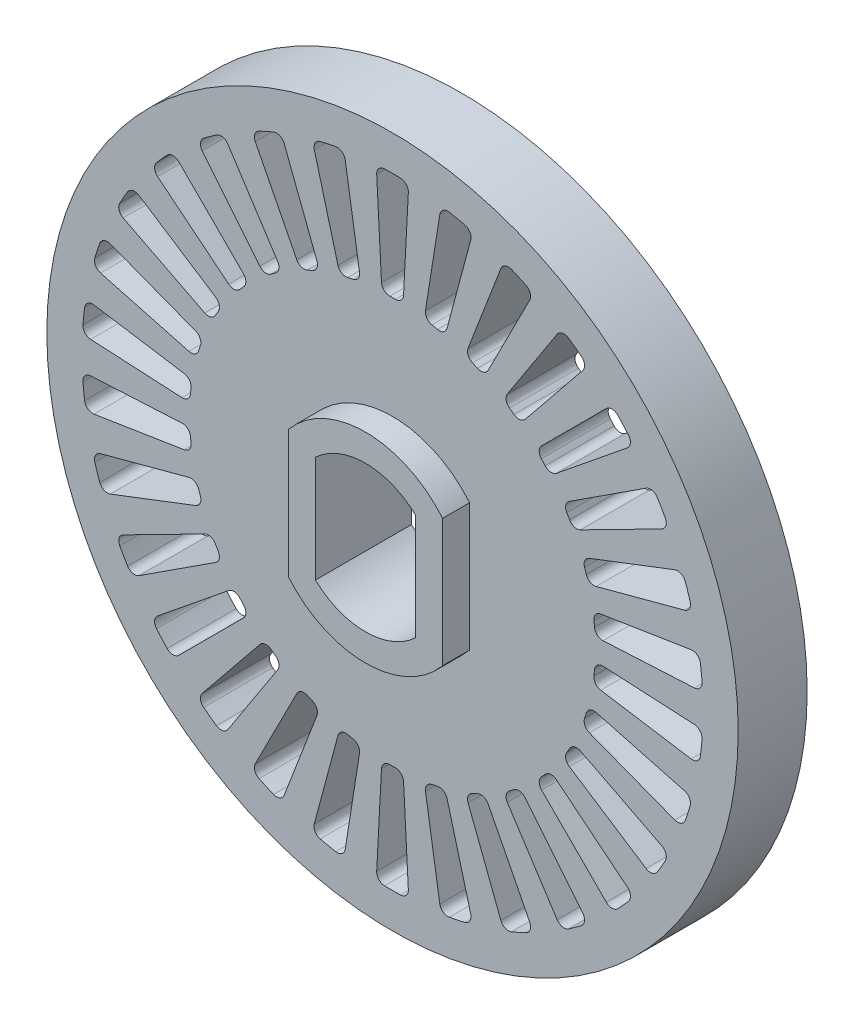
from build123d import *

# Parameters (mm, degrees)
ESBO_O1_R                = 12.78
RESSALTO_EXTRUS_O1_DEPTH = 2.55
RESSALTO_EXTRUS_O2_DEPTH = 3.55
CORTE_EXTRUS_O1_DEPTH    = 3.55


with BuildPart() as part:
    # Esboço1 → Ressalto-extrusão1 (new body)
    with BuildSketch(Plane.XY):
        Circle(ESBO_O1_R)
        with BuildLine():
            Line((-1.85, 1.966596044), (-1.85, -1.966596044))
            ThreePointArc((-1.85, -1.966596044), (0, -2.7), (1.85, -1.966596044))
            Line((1.85, -1.966596044), (1.85, 1.966596044))
            ThreePointArc((1.85, 1.966596044), (0, 2.7), (-1.85, 1.966596044))
        make_face(mode=Mode.SUBTRACT)
    extrude(amount=RESSALTO_EXTRUS_O1_DEPTH)

    # Esboço2 → Ressalto-extrusão2 (add)
    with BuildSketch(Plane.XY):
        with BuildLine():
            ThreePointArc((-2.85, -2.359555043), (0, -3.7), (2.85, -2.359555043))
            Line((2.85, -2.359555043), (2.85, 2.359555043))
            ThreePointArc((2.85, 2.359555043), (0, 3.7), (-2.85, 2.359555043))
            Line((-2.85, 2.359555043), (-2.85, -2.359555043))
        make_face()
        with BuildLine():
            Line((-1.85, 1.966596044), (-1.85, -1.966596044))
            ThreePointArc((-1.85, -1.966596044), (0, -2.7), (1.85, -1.966596044))
            Line((1.85, -1.966596044), (1.85, 1.966596044))
            ThreePointArc((1.85, 1.966596044), (0, 2.7), (-1.85, 1.966596044))
        make_face(mode=Mode.SUBTRACT)
    extrude(amount=RESSALTO_EXTRUS_O2_DEPTH)

    # Esboço3 → Corte-extrusão1 (cut)
    with BuildSketch(Plane.XY.offset(2.55)):
        with BuildLine():
            Line((0.407918409, 7.783546915), (0.584905298, 11.160657946))
            ThreePointArc((0.584905298, 11.160657946), (0.505546292, 11.380071304), (0.292972514, 11.476261025))
            ThreePointArc((0.292972514, 11.476261025), (0, 11.48), (-0.292972514, 11.476261025))
            ThreePointArc((-0.292972514, 11.476261025), (-0.505546292, 11.380071304), (-0.584905298, 11.160657946))
            Line((-0.584905298, 11.160657946), (-0.407918409, 7.783546915))
            ThreePointArc((-0.407918409, 7.783546915), (-0.313319761, 7.580206581), (-0.104163027, 7.499276636))
            ThreePointArc((-0.104163027, 7.499276636), (0, 7.5), (0.104163027, 7.499276636))
            ThreePointArc((0.104163027, 7.499276636), (0.313319761, 7.580206581), (0.407918409, 7.783546915))
        make_face()
        with BuildLine():
            Line((2.017294812, 7.528646734), (2.892554978, 10.795162143))
            ThreePointArc((2.892554978, 10.795162143), (2.860548759, 11.026280458), (2.672619196, 11.164564776))
            ThreePointArc((2.672619196, 11.164564776), (2.386826211, 11.229134456), (2.099478472, 11.286389597))
            ThreePointArc((2.099478472, 11.286389597), (1.871550974, 11.236498426), (1.74830755, 11.038379442))
            Line((1.74830755, 11.038379442), (1.219285987, 7.698268746))
            ThreePointArc((1.219285987, 7.698268746), (1.269540594, 7.479703721), (1.45730047, 7.35705616))
            ThreePointArc((1.45730047, 7.35705616), (1.559337681, 7.336107006), (1.6610741, 7.313742738))
            ThreePointArc((1.6610741, 7.313742738), (1.88248654, 7.349418039), (2.017294812, 7.528646734))
        make_face()
        with BuildLine():
            Line((3.538505753, 6.944708564), (5.073786126, 9.957865954))
            ThreePointArc((5.073786126, 9.957865954), (5.090531519, 10.190588246), (4.935459594, 10.364923473))
            ThreePointArc((4.935459594, 10.364923473), (4.669336663, 10.487501854), (4.400172175, 10.603248787))
            ThreePointArc((4.400172175, 10.603248787), (4.166852482, 10.601836649), (4.005110969, 10.433670789))
            Line((4.005110969, 10.433670789), (2.793201734, 7.276539292))
            ThreePointArc((2.793201734, 7.276539292), (2.796915934, 7.052301918), (2.955072944, 6.893297026))
            ThreePointArc((2.955072944, 6.893297026), (3.050524823, 6.851590932), (3.145388265, 6.808563186))
            ThreePointArc((3.145388265, 6.808563186), (3.369379623, 6.797424662), (3.538505753, 6.944708564))
        make_face()
        with BuildLine():
            Line((4.905067012, 6.057253306), (7.033268473, 8.685363239))
            ThreePointArc((7.033268473, 8.685363239), (7.098033624, 8.909518427), (6.982596724, 9.112285278))
            ThreePointArc((6.982596724, 9.112285278), (6.747774696, 9.287515095), (6.508557239, 9.456695124))
            ThreePointArc((6.508557239, 9.456695124), (6.280042541, 9.503823737), (6.08687182, 9.372960655))
            Line((6.08687182, 9.372960655), (4.245041162, 6.536790155))
            ThreePointArc((4.245041162, 6.536790155), (4.202052626, 6.31668068), (4.32369455, 6.128267735))
            ThreePointArc((4.32369455, 6.128267735), (4.408389392, 6.067627458), (4.492233869, 6.005816753))
            ThreePointArc((4.492233869, 6.005816753), (4.709014649, 5.94835121), (4.905067012, 6.057253306))
        make_face()
        with BuildLine():
            Line((6.057253306, 4.905067012), (8.685363239, 7.033268473))
            ThreePointArc((8.685363239, 7.033268473), (8.7953176, 7.239059901), (8.724560872, 7.46139649))
            ThreePointArc((8.724560872, 7.46139649), (8.531302596, 7.681619361), (8.33248712, 7.896838506))
            ThreePointArc((8.33248712, 7.896838506), (8.118764606, 7.990448123), (7.902607165, 7.902607165))
            Line((7.902607165, 7.902607165), (5.511351921, 5.511351921))
            ThreePointArc((5.511351921, 5.511351921), (5.423539455, 5.304990185), (5.503349957, 5.095403737))
            ThreePointArc((5.503349957, 5.095403737), (5.573586191, 5.018479548), (5.642747296, 4.940587308))
            ThreePointArc((5.642747296, 4.940587308), (5.842843139, 4.839306266), (6.057253306, 4.905067012))
        make_face()
        with BuildLine():
            Line((6.944708564, 3.538505753), (9.957865954, 5.073786126))
            ThreePointArc((9.957865954, 5.073786126), (10.108203992, 5.25221972), (10.085219845, 5.484408873))
            ThreePointArc((10.085219845, 5.484408873), (9.941971635, 5.74), (9.792247331, 5.991852152))
            ThreePointArc((9.792247331, 5.991852152), (9.6026577, 6.127851583), (9.372960655, 6.08687182))
            Line((9.372960655, 6.08687182), (6.536790155, 4.245041162))
            ThreePointArc((6.536790155, 4.245041162), (6.407991584, 4.061446163), (6.442482563, 3.839846146))
            ThreePointArc((6.442482563, 3.839846146), (6.495190528, 3.75), (6.54664559, 3.65943049))
            ThreePointArc((6.54664559, 3.65943049), (6.721311346, 3.518760418), (6.944708564, 3.538505753))
        make_face()
        with BuildLine():
            Line((7.528646734, 2.017294812), (10.795162143, 2.892554978))
            ThreePointArc((10.795162143, 2.892554978), (10.979313365, 3.035832335), (11.005106316, 3.26772627))
            ThreePointArc((11.005106316, 3.26772627), (10.918128807, 3.547515095), (10.824039344, 3.824993107))
            ThreePointArc((10.824039344, 3.824993107), (10.666868574, 3.997438525), (10.433670789, 4.005110969))
            Line((10.433670789, 4.005110969), (7.276539292, 2.793201734))
            ThreePointArc((7.276539292, 2.793201734), (7.112383733, 2.640397455), (7.100047767, 2.416468852))
            ThreePointArc((7.100047767, 2.416468852), (7.132923872, 2.317627458), (7.164424058, 2.218339))
            ThreePointArc((7.164424058, 2.218339), (7.306025995, 2.044427854), (7.528646734, 2.017294812))
        make_face()
        with BuildLine():
            Line((7.783546915, 0.407918409), (11.160657946, 0.584905298))
            ThreePointArc((11.160657946, 0.584905298), (11.370574059, 0.686764509), (11.444016833, 0.908228349))
            ThreePointArc((11.444016833, 0.908228349), (11.417111359, 1.199986758), (11.382768899, 1.490963509))
            ThreePointArc((11.382768899, 1.490963509), (11.264886105, 1.692318222), (11.038379442, 1.74830755))
            Line((11.038379442, 1.74830755), (7.698268746, 1.219285987))
            ThreePointArc((7.698268746, 1.219285987), (7.505930583, 1.103950708), (7.447306813, 0.887480274))
            ThreePointArc((7.447306813, 0.887480274), (7.458914215, 0.783963475), (7.469082815, 0.680295451))
            ThreePointArc((7.469082815, 0.680295451), (7.571432249, 0.480743982), (7.783546915, 0.407918409))
        make_face()
        with BuildLine():
            Line((7.698268746, -1.219285987), (11.038379442, -1.74830755))
            ThreePointArc((11.038379442, -1.74830755), (11.264886105, -1.692318222), (11.382768899, -1.490963509))
            ThreePointArc((11.382768899, -1.490963509), (11.417111359, -1.199986758), (11.444016833, -0.908228349))
            ThreePointArc((11.444016833, -0.908228349), (11.370574059, -0.686764509), (11.160657946, -0.584905298))
            Line((11.160657946, -0.584905298), (7.783546915, -0.407918409))
            ThreePointArc((7.783546915, -0.407918409), (7.571432249, -0.480743982), (7.469082815, -0.680295451))
            ThreePointArc((7.469082815, -0.680295451), (7.458914215, -0.783963475), (7.447306813, -0.887480274))
            ThreePointArc((7.447306813, -0.887480274), (7.505930583, -1.103950708), (7.698268746, -1.219285987))
        make_face()
        with BuildLine():
            Line((7.276539292, -2.793201734), (10.433670789, -4.005110969))
            ThreePointArc((10.433670789, -4.005110969), (10.666868574, -3.997438525), (10.824039344, -3.824993107))
            ThreePointArc((10.824039344, -3.824993107), (10.918128807, -3.547515095), (11.005106316, -3.26772627))
            ThreePointArc((11.005106316, -3.26772627), (10.979313365, -3.035832335), (10.795162143, -2.892554978))
            Line((10.795162143, -2.892554978), (7.528646734, -2.017294812))
            ThreePointArc((7.528646734, -2.017294812), (7.306025995, -2.044427854), (7.164424058, -2.218339))
            ThreePointArc((7.164424058, -2.218339), (7.132923872, -2.317627458), (7.100047767, -2.416468852))
            ThreePointArc((7.100047767, -2.416468852), (7.112383733, -2.640397455), (7.276539292, -2.793201734))
        make_face()
        with BuildLine():
            Line((6.536790155, -4.245041162), (9.372960655, -6.08687182))
            ThreePointArc((9.372960655, -6.08687182), (9.6026577, -6.127851583), (9.792247331, -5.991852152))
            ThreePointArc((9.792247331, -5.991852152), (9.941971635, -5.74), (10.085219845, -5.484408873))
            ThreePointArc((10.085219845, -5.484408873), (10.108203992, -5.25221972), (9.957865954, -5.073786126))
            Line((9.957865954, -5.073786126), (6.944708564, -3.538505753))
            ThreePointArc((6.944708564, -3.538505753), (6.721311346, -3.518760418), (6.54664559, -3.65943049))
            ThreePointArc((6.54664559, -3.65943049), (6.495190528, -3.75), (6.442482563, -3.839846146))
            ThreePointArc((6.442482563, -3.839846146), (6.407991584, -4.061446163), (6.536790155, -4.245041162))
        make_face()
        with BuildLine():
            Line((5.511351921, -5.511351921), (7.902607165, -7.902607165))
            ThreePointArc((7.902607165, -7.902607165), (8.118764606, -7.990448123), (8.33248712, -7.896838506))
            ThreePointArc((8.33248712, -7.896838506), (8.531302596, -7.681619361), (8.724560872, -7.46139649))
            ThreePointArc((8.724560872, -7.46139649), (8.7953176, -7.239059901), (8.685363239, -7.033268473))
            Line((8.685363239, -7.033268473), (6.057253306, -4.905067012))
            ThreePointArc((6.057253306, -4.905067012), (5.842843139, -4.839306266), (5.642747296, -4.940587308))
            ThreePointArc((5.642747296, -4.940587308), (5.573586191, -5.018479548), (5.503349957, -5.095403737))
            ThreePointArc((5.503349957, -5.095403737), (5.423539455, -5.304990185), (5.511351921, -5.511351921))
        make_face()
        with BuildLine():
            Line((4.245041162, -6.536790155), (6.08687182, -9.372960655))
            ThreePointArc((6.08687182, -9.372960655), (6.280042541, -9.503823737), (6.508557239, -9.456695124))
            ThreePointArc((6.508557239, -9.456695124), (6.747774696, -9.287515095), (6.982596724, -9.112285278))
            ThreePointArc((6.982596724, -9.112285278), (7.098033624, -8.909518427), (7.033268473, -8.685363239))
            Line((7.033268473, -8.685363239), (4.905067012, -6.057253306))
            ThreePointArc((4.905067012, -6.057253306), (4.709014649, -5.94835121), (4.492233869, -6.005816753))
            ThreePointArc((4.492233869, -6.005816753), (4.408389392, -6.067627458), (4.32369455, -6.128267735))
            ThreePointArc((4.32369455, -6.128267735), (4.202052626, -6.31668068), (4.245041162, -6.536790155))
        make_face()
        with BuildLine():
            Line((2.793201734, -7.276539292), (4.005110969, -10.433670789))
            ThreePointArc((4.005110969, -10.433670789), (4.166852482, -10.601836649), (4.400172175, -10.603248787))
            ThreePointArc((4.400172175, -10.603248787), (4.669336663, -10.487501854), (4.935459594, -10.364923473))
            ThreePointArc((4.935459594, -10.364923473), (5.090531519, -10.190588246), (5.073786126, -9.957865954))
            Line((5.073786126, -9.957865954), (3.538505753, -6.944708564))
            ThreePointArc((3.538505753, -6.944708564), (3.369379623, -6.797424662), (3.145388265, -6.808563186))
            ThreePointArc((3.145388265, -6.808563186), (3.050524823, -6.851590932), (2.955072944, -6.893297026))
            ThreePointArc((2.955072944, -6.893297026), (2.796915934, -7.052301918), (2.793201734, -7.276539292))
        make_face()
        with BuildLine():
            Line((1.219285987, -7.698268746), (1.74830755, -11.038379442))
            ThreePointArc((1.74830755, -11.038379442), (1.871550974, -11.236498426), (2.099478472, -11.286389597))
            ThreePointArc((2.099478472, -11.286389597), (2.386826211, -11.229134456), (2.672619196, -11.164564776))
            ThreePointArc((2.672619196, -11.164564776), (2.860548759, -11.026280458), (2.892554978, -10.795162143))
            Line((2.892554978, -10.795162143), (2.017294812, -7.528646734))
            ThreePointArc((2.017294812, -7.528646734), (1.88248654, -7.349418039), (1.6610741, -7.313742738))
            ThreePointArc((1.6610741, -7.313742738), (1.559337681, -7.336107006), (1.45730047, -7.35705616))
            ThreePointArc((1.45730047, -7.35705616), (1.269540594, -7.479703721), (1.219285987, -7.698268746))
        make_face()
        with BuildLine():
            Line((-0.407918409, -7.783546915), (-0.584905298, -11.160657946))
            ThreePointArc((-0.584905298, -11.160657946), (-0.505546292, -11.380071304), (-0.292972514, -11.476261025))
            ThreePointArc((-0.292972514, -11.476261025), (0, -11.48), (0.292972514, -11.476261025))
            ThreePointArc((0.292972514, -11.476261025), (0.505546292, -11.380071304), (0.584905298, -11.160657946))
            Line((0.584905298, -11.160657946), (0.407918409, -7.783546915))
            ThreePointArc((0.407918409, -7.783546915), (0.313319761, -7.580206581), (0.104163027, -7.499276636))
            ThreePointArc((0.104163027, -7.499276636), (0, -7.5), (-0.104163027, -7.499276636))
            ThreePointArc((-0.104163027, -7.499276636), (-0.313319761, -7.580206581), (-0.407918409, -7.783546915))
        make_face()
        with BuildLine():
            Line((-2.017294812, -7.528646734), (-2.892554978, -10.795162143))
            ThreePointArc((-2.892554978, -10.795162143), (-2.860548759, -11.026280458), (-2.672619196, -11.164564776))
            ThreePointArc((-2.672619196, -11.164564776), (-2.386826211, -11.229134456), (-2.099478472, -11.286389597))
            ThreePointArc((-2.099478472, -11.286389597), (-1.871550974, -11.236498426), (-1.74830755, -11.038379442))
            Line((-1.74830755, -11.038379442), (-1.219285987, -7.698268746))
            ThreePointArc((-1.219285987, -7.698268746), (-1.269540594, -7.479703721), (-1.45730047, -7.35705616))
            ThreePointArc((-1.45730047, -7.35705616), (-1.559337681, -7.336107006), (-1.6610741, -7.313742738))
            ThreePointArc((-1.6610741, -7.313742738), (-1.88248654, -7.349418039), (-2.017294812, -7.528646734))
        make_face()
        with BuildLine():
            Line((-3.538505753, -6.944708564), (-5.073786126, -9.957865954))
            ThreePointArc((-5.073786126, -9.957865954), (-5.090531519, -10.190588246), (-4.935459594, -10.364923473))
            ThreePointArc((-4.935459594, -10.364923473), (-4.669336663, -10.487501854), (-4.400172175, -10.603248787))
            ThreePointArc((-4.400172175, -10.603248787), (-4.166852482, -10.601836649), (-4.005110969, -10.433670789))
            Line((-4.005110969, -10.433670789), (-2.793201734, -7.276539292))
            ThreePointArc((-2.793201734, -7.276539292), (-2.796915934, -7.052301918), (-2.955072944, -6.893297026))
            ThreePointArc((-2.955072944, -6.893297026), (-3.050524823, -6.851590932), (-3.145388265, -6.808563186))
            ThreePointArc((-3.145388265, -6.808563186), (-3.369379623, -6.797424662), (-3.538505753, -6.944708564))
        make_face()
        with BuildLine():
            Line((-4.905067012, -6.057253306), (-7.033268473, -8.685363239))
            ThreePointArc((-7.033268473, -8.685363239), (-7.098033624, -8.909518427), (-6.982596724, -9.112285278))
            ThreePointArc((-6.982596724, -9.112285278), (-6.747774696, -9.287515095), (-6.508557239, -9.456695124))
            ThreePointArc((-6.508557239, -9.456695124), (-6.280042541, -9.503823737), (-6.08687182, -9.372960655))
            Line((-6.08687182, -9.372960655), (-4.245041162, -6.536790155))
            ThreePointArc((-4.245041162, -6.536790155), (-4.202052626, -6.31668068), (-4.32369455, -6.128267735))
            ThreePointArc((-4.32369455, -6.128267735), (-4.408389392, -6.067627458), (-4.492233869, -6.005816753))
            ThreePointArc((-4.492233869, -6.005816753), (-4.709014649, -5.94835121), (-4.905067012, -6.057253306))
        make_face()
        with BuildLine():
            Line((-6.057253306, -4.905067012), (-8.685363239, -7.033268473))
            ThreePointArc((-8.685363239, -7.033268473), (-8.7953176, -7.239059901), (-8.724560872, -7.46139649))
            ThreePointArc((-8.724560872, -7.46139649), (-8.531302596, -7.681619361), (-8.33248712, -7.896838506))
            ThreePointArc((-8.33248712, -7.896838506), (-8.118764606, -7.990448123), (-7.902607165, -7.902607165))
            Line((-7.902607165, -7.902607165), (-5.511351921, -5.511351921))
            ThreePointArc((-5.511351921, -5.511351921), (-5.423539455, -5.304990185), (-5.503349957, -5.095403737))
            ThreePointArc((-5.503349957, -5.095403737), (-5.573586191, -5.018479548), (-5.642747296, -4.940587308))
            ThreePointArc((-5.642747296, -4.940587308), (-5.842843139, -4.839306266), (-6.057253306, -4.905067012))
        make_face()
        with BuildLine():
            Line((-6.944708564, -3.538505753), (-9.957865954, -5.073786126))
            ThreePointArc((-9.957865954, -5.073786126), (-10.108203992, -5.25221972), (-10.085219845, -5.484408873))
            ThreePointArc((-10.085219845, -5.484408873), (-9.941971635, -5.74), (-9.792247331, -5.991852152))
            ThreePointArc((-9.792247331, -5.991852152), (-9.6026577, -6.127851583), (-9.372960655, -6.08687182))
            Line((-9.372960655, -6.08687182), (-6.536790155, -4.245041162))
            ThreePointArc((-6.536790155, -4.245041162), (-6.407991584, -4.061446163), (-6.442482563, -3.839846146))
            ThreePointArc((-6.442482563, -3.839846146), (-6.495190528, -3.75), (-6.54664559, -3.65943049))
            ThreePointArc((-6.54664559, -3.65943049), (-6.721311346, -3.518760418), (-6.944708564, -3.538505753))
        make_face()
        with BuildLine():
            Line((-7.528646734, -2.017294812), (-10.795162143, -2.892554978))
            ThreePointArc((-10.795162143, -2.892554978), (-10.979313365, -3.035832335), (-11.005106316, -3.26772627))
            ThreePointArc((-11.005106316, -3.26772627), (-10.918128807, -3.547515095), (-10.824039344, -3.824993107))
            ThreePointArc((-10.824039344, -3.824993107), (-10.666868574, -3.997438525), (-10.433670789, -4.005110969))
            Line((-10.433670789, -4.005110969), (-7.276539292, -2.793201734))
            ThreePointArc((-7.276539292, -2.793201734), (-7.112383733, -2.640397455), (-7.100047767, -2.416468852))
            ThreePointArc((-7.100047767, -2.416468852), (-7.132923872, -2.317627458), (-7.164424058, -2.218339))
            ThreePointArc((-7.164424058, -2.218339), (-7.306025995, -2.044427854), (-7.528646734, -2.017294812))
        make_face()
        with BuildLine():
            Line((-7.783546915, -0.407918409), (-11.160657946, -0.584905298))
            ThreePointArc((-11.160657946, -0.584905298), (-11.370574059, -0.686764509), (-11.444016833, -0.908228349))
            ThreePointArc((-11.444016833, -0.908228349), (-11.417111359, -1.199986758), (-11.382768899, -1.490963509))
            ThreePointArc((-11.382768899, -1.490963509), (-11.264886105, -1.692318222), (-11.038379442, -1.74830755))
            Line((-11.038379442, -1.74830755), (-7.698268746, -1.219285987))
            ThreePointArc((-7.698268746, -1.219285987), (-7.505930583, -1.103950708), (-7.447306813, -0.887480274))
            ThreePointArc((-7.447306813, -0.887480274), (-7.458914215, -0.783963475), (-7.469082815, -0.680295451))
            ThreePointArc((-7.469082815, -0.680295451), (-7.571432249, -0.480743982), (-7.783546915, -0.407918409))
        make_face()
        with BuildLine():
            Line((-7.698268746, 1.219285987), (-11.038379442, 1.74830755))
            ThreePointArc((-11.038379442, 1.74830755), (-11.264886105, 1.692318222), (-11.382768899, 1.490963509))
            ThreePointArc((-11.382768899, 1.490963509), (-11.417111359, 1.199986758), (-11.444016833, 0.908228349))
            ThreePointArc((-11.444016833, 0.908228349), (-11.370574059, 0.686764509), (-11.160657946, 0.584905298))
            Line((-11.160657946, 0.584905298), (-7.783546915, 0.407918409))
            ThreePointArc((-7.783546915, 0.407918409), (-7.571432249, 0.480743982), (-7.469082815, 0.680295451))
            ThreePointArc((-7.469082815, 0.680295451), (-7.458914215, 0.783963475), (-7.447306813, 0.887480274))
            ThreePointArc((-7.447306813, 0.887480274), (-7.505930583, 1.103950708), (-7.698268746, 1.219285987))
        make_face()
        with BuildLine():
            Line((-7.276539292, 2.793201734), (-10.433670789, 4.005110969))
            ThreePointArc((-10.433670789, 4.005110969), (-10.666868574, 3.997438525), (-10.824039344, 3.824993107))
            ThreePointArc((-10.824039344, 3.824993107), (-10.918128807, 3.547515095), (-11.005106316, 3.26772627))
            ThreePointArc((-11.005106316, 3.26772627), (-10.979313365, 3.035832335), (-10.795162143, 2.892554978))
            Line((-10.795162143, 2.892554978), (-7.528646734, 2.017294812))
            ThreePointArc((-7.528646734, 2.017294812), (-7.306025995, 2.044427854), (-7.164424058, 2.218339))
            ThreePointArc((-7.164424058, 2.218339), (-7.132923872, 2.317627458), (-7.100047767, 2.416468852))
            ThreePointArc((-7.100047767, 2.416468852), (-7.112383733, 2.640397455), (-7.276539292, 2.793201734))
        make_face()
        with BuildLine():
            Line((-6.536790155, 4.245041162), (-9.372960655, 6.08687182))
            ThreePointArc((-9.372960655, 6.08687182), (-9.6026577, 6.127851583), (-9.792247331, 5.991852152))
            ThreePointArc((-9.792247331, 5.991852152), (-9.941971635, 5.74), (-10.085219845, 5.484408873))
            ThreePointArc((-10.085219845, 5.484408873), (-10.108203992, 5.25221972), (-9.957865954, 5.073786126))
            Line((-9.957865954, 5.073786126), (-6.944708564, 3.538505753))
            ThreePointArc((-6.944708564, 3.538505753), (-6.721311346, 3.518760418), (-6.54664559, 3.65943049))
            ThreePointArc((-6.54664559, 3.65943049), (-6.495190528, 3.75), (-6.442482563, 3.839846146))
            ThreePointArc((-6.442482563, 3.839846146), (-6.407991584, 4.061446163), (-6.536790155, 4.245041162))
        make_face()
        with BuildLine():
            Line((-5.511351921, 5.511351921), (-7.902607165, 7.902607165))
            ThreePointArc((-7.902607165, 7.902607165), (-8.118764606, 7.990448123), (-8.33248712, 7.896838506))
            ThreePointArc((-8.33248712, 7.896838506), (-8.531302596, 7.681619361), (-8.724560872, 7.46139649))
            ThreePointArc((-8.724560872, 7.46139649), (-8.7953176, 7.239059901), (-8.685363239, 7.033268473))
            Line((-8.685363239, 7.033268473), (-6.057253306, 4.905067012))
            ThreePointArc((-6.057253306, 4.905067012), (-5.842843139, 4.839306266), (-5.642747296, 4.940587308))
            ThreePointArc((-5.642747296, 4.940587308), (-5.573586191, 5.018479548), (-5.503349957, 5.095403737))
            ThreePointArc((-5.503349957, 5.095403737), (-5.423539455, 5.304990185), (-5.511351921, 5.511351921))
        make_face()
        with BuildLine():
            Line((-4.245041162, 6.536790155), (-6.08687182, 9.372960655))
            ThreePointArc((-6.08687182, 9.372960655), (-6.280042541, 9.503823737), (-6.508557239, 9.456695124))
            ThreePointArc((-6.508557239, 9.456695124), (-6.747774696, 9.287515095), (-6.982596724, 9.112285278))
            ThreePointArc((-6.982596724, 9.112285278), (-7.098033624, 8.909518427), (-7.033268473, 8.685363239))
            Line((-7.033268473, 8.685363239), (-4.905067012, 6.057253306))
            ThreePointArc((-4.905067012, 6.057253306), (-4.709014649, 5.94835121), (-4.492233869, 6.005816753))
            ThreePointArc((-4.492233869, 6.005816753), (-4.408389392, 6.067627458), (-4.32369455, 6.128267735))
            ThreePointArc((-4.32369455, 6.128267735), (-4.202052626, 6.31668068), (-4.245041162, 6.536790155))
        make_face()
        with BuildLine():
            Line((-2.793201734, 7.276539292), (-4.005110969, 10.433670789))
            ThreePointArc((-4.005110969, 10.433670789), (-4.166852482, 10.601836649), (-4.400172175, 10.603248787))
            ThreePointArc((-4.400172175, 10.603248787), (-4.669336663, 10.487501854), (-4.935459594, 10.364923473))
            ThreePointArc((-4.935459594, 10.364923473), (-5.090531519, 10.190588246), (-5.073786126, 9.957865954))
            Line((-5.073786126, 9.957865954), (-3.538505753, 6.944708564))
            ThreePointArc((-3.538505753, 6.944708564), (-3.369379623, 6.797424662), (-3.145388265, 6.808563186))
            ThreePointArc((-3.145388265, 6.808563186), (-3.050524823, 6.851590932), (-2.955072944, 6.893297026))
            ThreePointArc((-2.955072944, 6.893297026), (-2.796915934, 7.052301918), (-2.793201734, 7.276539292))
        make_face()
        with BuildLine():
            Line((-1.219285987, 7.698268746), (-1.74830755, 11.038379442))
            ThreePointArc((-1.74830755, 11.038379442), (-1.871550974, 11.236498426), (-2.099478472, 11.286389597))
            ThreePointArc((-2.099478472, 11.286389597), (-2.386826211, 11.229134456), (-2.672619196, 11.164564776))
            ThreePointArc((-2.672619196, 11.164564776), (-2.860548759, 11.026280458), (-2.892554978, 10.795162143))
            Line((-2.892554978, 10.795162143), (-2.017294812, 7.528646734))
            ThreePointArc((-2.017294812, 7.528646734), (-1.88248654, 7.349418039), (-1.6610741, 7.313742738))
            ThreePointArc((-1.6610741, 7.313742738), (-1.559337681, 7.336107006), (-1.45730047, 7.35705616))
            ThreePointArc((-1.45730047, 7.35705616), (-1.269540594, 7.479703721), (-1.219285987, 7.698268746))
        make_face()
    extrude(amount=-CORTE_EXTRUS_O1_DEPTH, mode=Mode.SUBTRACT)


solid = part.part
